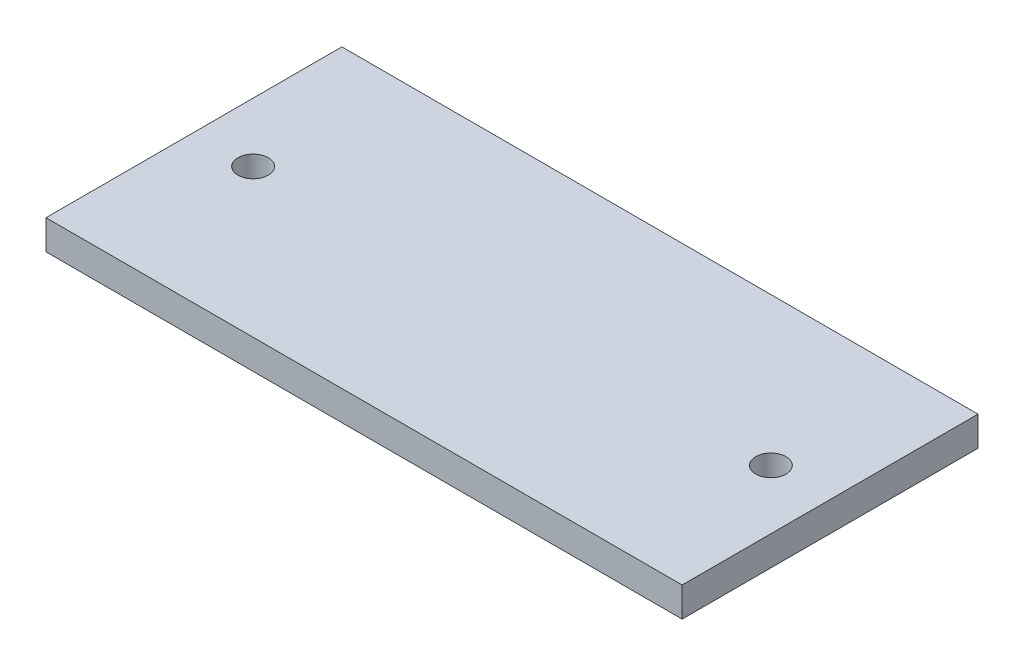
from build123d import *

# Parameters (mm, degrees)
SKETCH1_W           = 43
SKETCH1_H           = 20
SKETCH1_R           = 1.025
BOSS_EXTRUDE1_DEPTH = 2


with BuildPart() as part:
    # Sketch1 → Boss-Extrude1 (new body)
    with BuildSketch(Plane(origin=(0, 0, 0), x_dir=(1, 0, 0), z_dir=(0, 1, 0))):
        Rectangle(SKETCH1_W, SKETCH1_H)
        with Locations(Location((-17.5, 0, 0), (0, 0, 270))):
            Circle(SKETCH1_R, mode=Mode.SUBTRACT)
        with Locations(Location((17.5, 0, 0), (0, 0, 270))):
            Circle(SKETCH1_R, mode=Mode.SUBTRACT)
    extrude(amount=BOSS_EXTRUDE1_DEPTH)


solid = part.part
